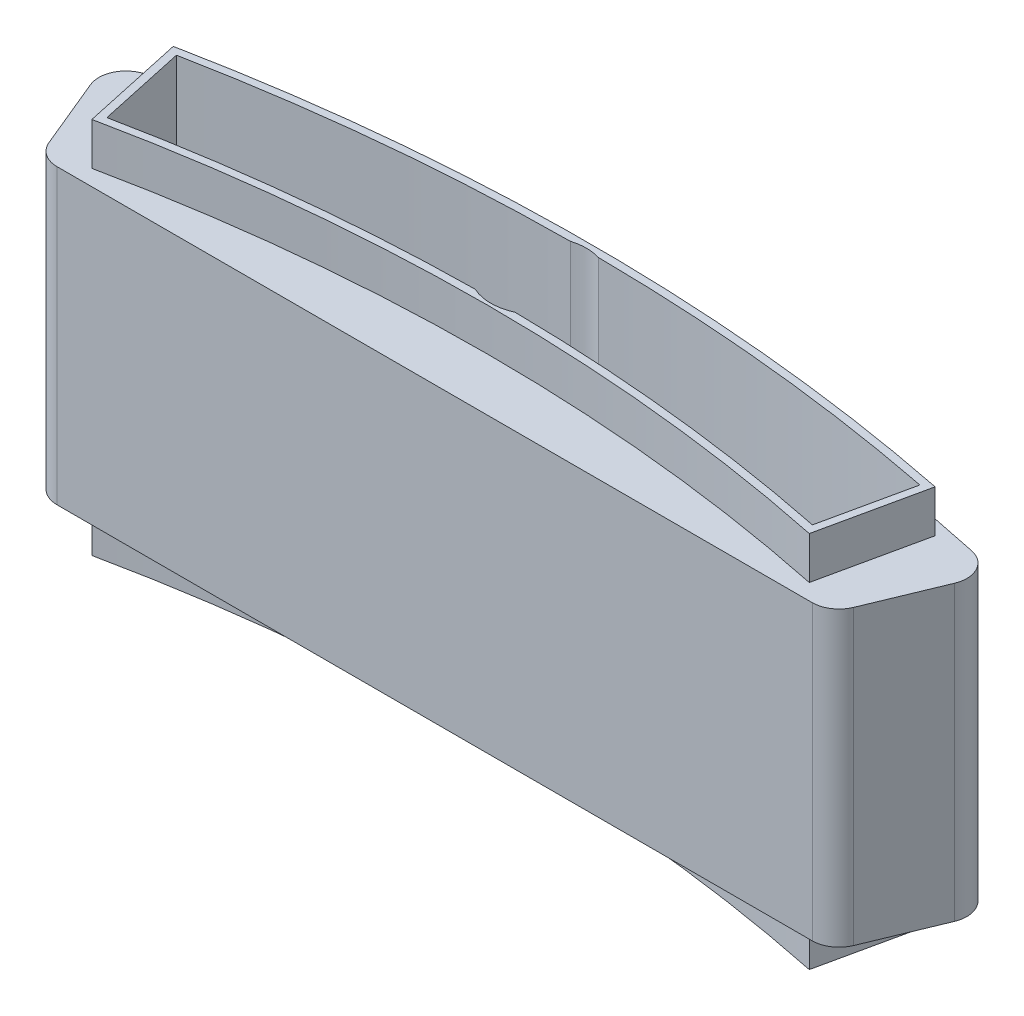
from build123d import *

# Parameters (mm, degrees)
BOSS_EXTRUDE1_DEPTH     = 9.5
BOSS_EXTRUDE4_DEPTH     = 19
BOSS_EXTRUDE5_DEPTH     = 2.75
CUT_EXTRUDE1_DEPTH      = 37.007750295
CUT_EXTRUDE1_DEPTH_BACK = 37.007750295
CUT_EXTRUDE2_DEPTH      = 38.700107179
CUT_EXTRUDE2_DEPTH_BACK = 38.700107179
SKETCH8_R               = 3.1


with BuildPart() as part:
    # Sketch1 → Boss-Extrude1 (new, symmetric)
    with BuildSketch(Plane(origin=(0, 0, 0), x_dir=(1, 0, 0), z_dir=(0, 1, 0))):
        with BuildLine():
            Line((-28.019427969, 0.30265419), (-26.106010807, -4.316743473))
            ThreePointArc((-26.106010807, -4.316743473), (-25.466467114, -5.100606473), (-24.5, -5.399602554))
            Line((-24.5, -5.399602554), (24.5, -5.399578272))
            ThreePointArc((24.5, -5.399578272), (25.457917057, -5.106354456), (26.098112281, -4.3358122))
            Line((26.098112281, -4.3358122), (28.019427969, 0.30265419))
            ThreePointArc((28.019427969, 0.30265419), (27.954595682, 1.785598461), (26.77403281, 2.685375236))
            ThreePointArc((26.77403281, 2.685375236), (0, 5.555679504), (-26.77374766, 2.682716614))
            ThreePointArc((-26.77374766, 2.682716614), (-27.953111468, 1.783959509), (-28.019427969, 0.30265419))
        make_face()
        with BuildLine():
            Line((-26.90965458, 0.889831635), (-24.967422855, -3.799130535))
            ThreePointArc((-24.967422855, -3.799130535), (-24.732603169, -4.057099402), (-24.386863498, -4.103492305))
            ThreePointArc((-24.386863498, -4.103492305), (0, -1.488014765), (24.386863498, -4.103492305))
            ThreePointArc((24.386863498, -4.103492305), (24.690465194, -4.081962763), (24.928721144, -3.892564732))
            Line((24.928721144, -3.892564732), (26.842138305, 0.72683293))
            ThreePointArc((26.842138305, 0.72683293), (26.889731767, 1.205196592), (26.51532004, 1.506714071))
            ThreePointArc((26.51532004, 1.506714071), (0, 4.351330223), (-26.51532004, 1.506714071))
            ThreePointArc((-26.51532004, 1.506714071), (-26.843311912, 1.281900877), (-26.90965458, 0.889831635))
        make_face(mode=Mode.SUBTRACT)
    extrude(amount=BOSS_EXTRUDE1_DEPTH, both=True)

    # Sketch5 → Boss-Extrude4 (add)
    with BuildSketch(Plane(origin=(0, 9.5, 0), x_dir=(1, 0, 0), z_dir=(0, 1, 0))):
        with BuildLine():
            Line((-28.019427969, 0.30265419), (-26.106010807, -4.316743473))
            ThreePointArc((-26.106010807, -4.316743473), (-25.466467114, -5.100606473), (-24.5, -5.399602554))
            Line((-24.5, -5.399602554), (24.5, -5.399578272))
            ThreePointArc((24.5, -5.399578272), (25.457917057, -5.106354456), (26.098112281, -4.3358122))
            Line((26.098112281, -4.3358122), (28.019427969, 0.30265419))
            ThreePointArc((28.019427969, 0.30265419), (27.954595682, 1.785598461), (26.77403281, 2.685375236))
            ThreePointArc((26.77403281, 2.685375236), (0, 5.555679504), (-26.77374766, 2.682716614))
            ThreePointArc((-26.77374766, 2.682716614), (-27.953111468, 1.783959509), (-28.019427969, 0.30265419))
        make_face()
        with BuildLine():
            Line((24.128669413, 1.955613279), (22.885024946, -3.772265844))
            ThreePointArc((22.885024946, -3.772265844), (0.000255966, -1.464252732), (-22.884068151, -3.776672574))
            Line((-22.884068151, -3.776672574), (-24.135292964, 1.986119507))
            ThreePointArc((-24.135292964, 1.986119507), (-0.001831478, 4.312848519), (24.128669413, 1.955613279))
        make_face(mode=Mode.SUBTRACT)
    extrude(amount=-BOSS_EXTRUDE4_DEPTH)

    # Sketch6 → Boss-Extrude5 (add)
    with BuildSketch(Plane(origin=(0, 9.5, 0), x_dir=(1, 0, 0), z_dir=(0, 1, 0))):
        with BuildLine():
            Line((-24.732023245, 2.377976913), (-23.267684412, -4.366358828))
            ThreePointArc((-23.267684412, -4.366358828), (0.000256463, -1.964252734), (23.268661469, -4.361858777))
            Line((23.268661469, -4.361858777), (24.725263361, 2.346842775))
            ThreePointArc((24.725263361, 2.346842775), (-0.001837352, 4.812848622), (-24.732023245, 2.377976913))
        make_face()
        with BuildLine():
            Line((-23.538121832, 1.592231661), (-22.5, -3.189067597))
            ThreePointArc((-22.5, -3.189067597), (0.000255268, -0.964252729), (22.500936706, -3.184753392))
            Line((22.500936706, -3.184753392), (23.531635738, 1.562358523))
            ThreePointArc((23.531635738, 1.562358523), (-0.001824238, 3.812848414), (-23.538121832, 1.592231661))
        make_face(mode=Mode.SUBTRACT)
    boss_extrude5 = extrude(amount=BOSS_EXTRUDE5_DEPTH)

    # Mirror1: Boss-Extrude5 across plane
    add(boss_extrude5.mirror(Plane.ZX))

    # Sketch5<2> → Cut-Extrude1 (cut, two sides: drawn at the far end of the back side and taken through both)
    with BuildSketch(Plane(origin=(0, 9.5, 0), x_dir=(1, 0, 0), z_dir=(0, 1, 0)).offset(-CUT_EXTRUDE1_DEPTH_BACK)):
        with BuildLine():
            Line((24.128669413, 1.955613279), (22.885024946, -3.772265844))
            ThreePointArc((22.885024946, -3.772265844), (0.000255966, -1.464252732), (-22.884068151, -3.776672574))
            Line((-22.884068151, -3.776672574), (-24.135292964, 1.986119507))
            ThreePointArc((-24.135292964, 1.986119507), (-0.001831478, 4.312848519), (24.128669413, 1.955613279))
        make_face()
    extrude(amount=CUT_EXTRUDE1_DEPTH + CUT_EXTRUDE1_DEPTH_BACK, mode=Mode.SUBTRACT)

    # Sketch8 → Cut-Extrude2 (cut, two sides: drawn at the far end of the back side and taken through both)
    with BuildSketch(Plane(origin=(0, 12.2, 0), x_dir=(1, 0, 0), z_dir=(0, 1, 0)).offset(-CUT_EXTRUDE2_DEPTH_BACK)):
        with Locations((0, 1.34568742)):
            Circle(SKETCH8_R)
    extrude(amount=CUT_EXTRUDE2_DEPTH + CUT_EXTRUDE2_DEPTH_BACK, mode=Mode.SUBTRACT)


solid = part.part
